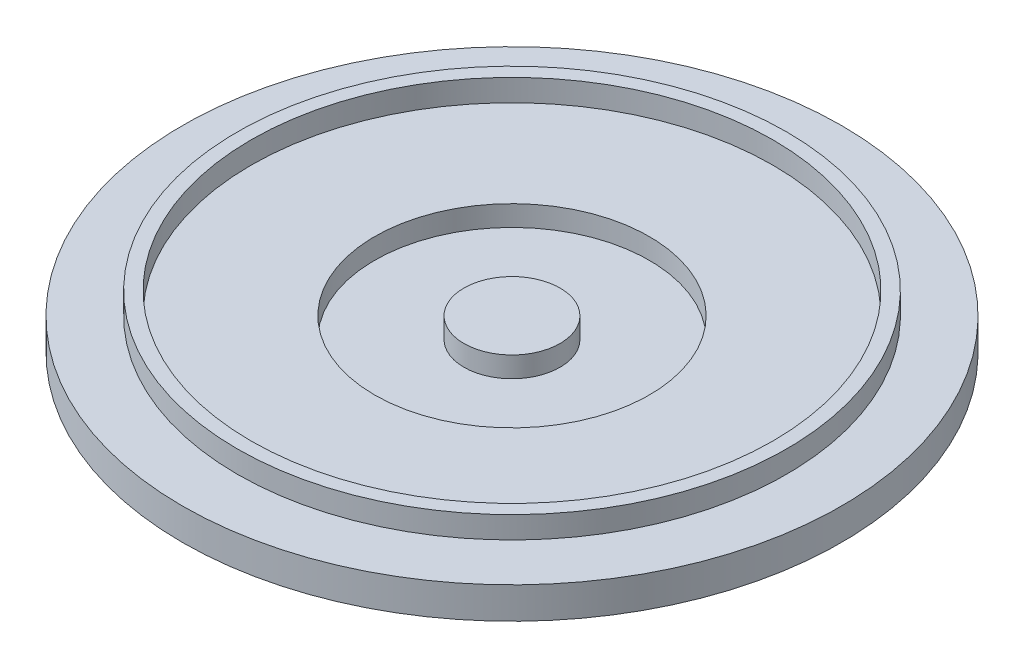
from build123d import *

# Parameters (mm, degrees)
SKETCH1_R           = 24
BOSS_EXTRUDE1_DEPTH = 2.3
SKETCH2_R           = 10
SKETCH2_R_2         = 3.5
CUT_EXTRUDE1_DEPTH  = 1.5
SKETCH3_R           = 20
SKETCH3_R_2         = 19
BOSS_EXTRUDE2_DEPTH = 1.6


with BuildPart() as part:
    # Sketch1 → Boss-Extrude1 (new body)
    with BuildSketch(Plane(origin=(0, 0, 0), x_dir=(1, 0, 0), z_dir=(0, 1, 0))):
        with Locations(Location((0, 0, 0), (0, 0, 270))):
            Circle(SKETCH1_R)
    extrude(amount=BOSS_EXTRUDE1_DEPTH)

    # Sketch2 → Cut-Extrude1 (cut)
    with BuildSketch(Plane(origin=(0, 2.3, 0), x_dir=(1, 0, 0), z_dir=(0, 1, 0))):
        with Locations(Location((0, 0, 0), (0, 0, 270))):
            Circle(SKETCH2_R)
        with Locations(Location((0, 0, 0), (0, 0, 270))):
            Circle(SKETCH2_R_2, mode=Mode.SUBTRACT)
    extrude(amount=-CUT_EXTRUDE1_DEPTH, mode=Mode.SUBTRACT)

    # Sketch3 → Boss-Extrude2 (add)
    with BuildSketch(Plane(origin=(0, 2.3, 0), x_dir=(1, 0, 0), z_dir=(0, 1, 0))):
        with Locations(Location((0, 0, 0), (0, 0, 270))):
            Circle(SKETCH3_R)
        with Locations(Location((0, 0, 0), (0, 0, 270))):
            Circle(SKETCH3_R_2, mode=Mode.SUBTRACT)
    extrude(amount=BOSS_EXTRUDE2_DEPTH)


solid = part.part
